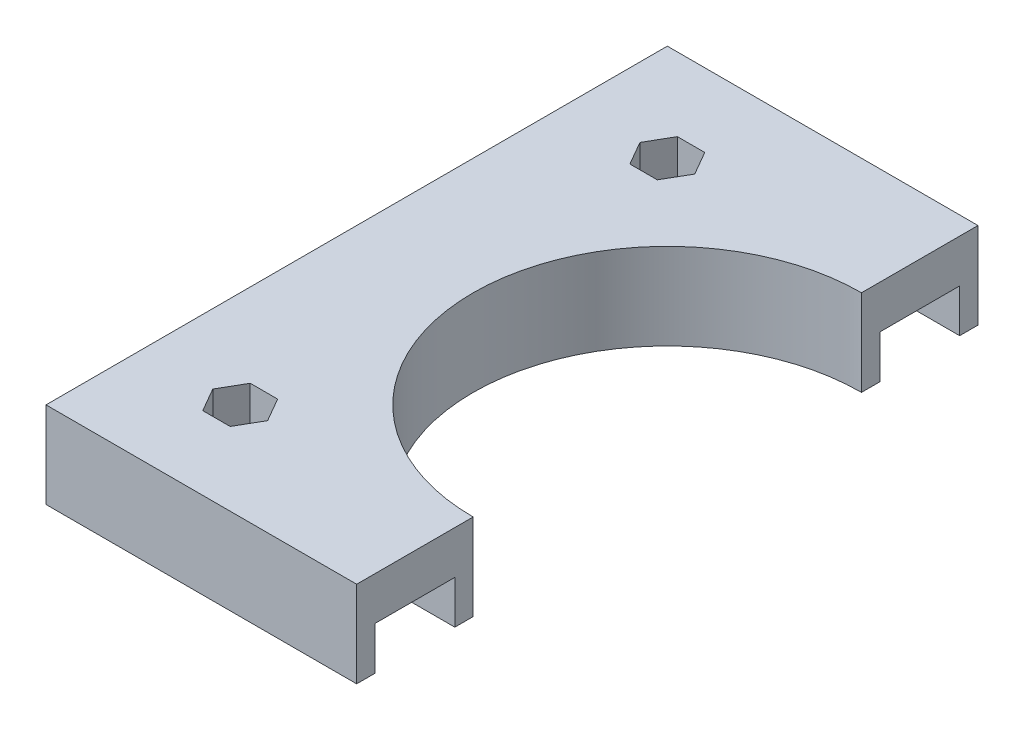
from build123d import *

# Parameters (mm, degrees)
BOSS_EXTRUDE1_DEPTH      = 5
BOSS_EXTRUDE1_DEPTH_BACK = 5
SKETCH1_R                = 1.5
CUT_EXTRUDE1_DEPTH       = 5
SKETCH4_W                = 9.454278837
SKETCH4_H                = 9.25
CUT_EXTRUDE2_DEPTH       = 5


with BuildPart() as part:
    # Sketch1 → Boss-Extrude1 (new, two sides: drawn at the far end of the back side and taken through both)
    with BuildSketch(Plane(origin=(0, 0, 0), x_dir=(1, 0, 0), z_dir=(0, 1, 0)).offset(-BOSS_EXTRUDE1_DEPTH_BACK)):
        with BuildLine():
            Line((0, 22.5), (0, 36))
            Line((0, 36), (-36, 36))
            Line((-36, 36), (-36, -36))
            Line((-36, -36), (0, -36))
            Line((0, -36), (0, -22.5))
            ThreePointArc((0, -22.5), (-22.5, 0), (0, 22.5))
        make_face()
        with Locations((-24.748737342, -24.748737342)):
            Circle(SKETCH1_R, mode=Mode.SUBTRACT)
        with Locations((-24.748737342, 24.748737342)):
            Circle(SKETCH1_R, mode=Mode.SUBTRACT)
    extrude(amount=BOSS_EXTRUDE1_DEPTH + BOSS_EXTRUDE1_DEPTH_BACK)

    # Sketch2 → Cut-Extrude1 (cut)
    with BuildSketch(Plane(origin=(0, 5, 0), x_dir=(1, 0, 0), z_dir=(0, 1, 0))):
        Polygon((-23.161024101, 27.498737342), (-26.336450582, 27.498737342), (-27.924163822, 24.748737342), (-26.336450582, 21.998737342), (-23.161024101, 21.998737342), (-21.573310861, 24.748737342), align=None)
    cut_extrude1 = extrude(amount=-CUT_EXTRUDE1_DEPTH, mode=Mode.SUBTRACT)

    # Mirror1: Cut-Extrude1 across plane
    add(cut_extrude1.mirror(Plane.XY), mode=Mode.SUBTRACT)

    # Sketch4 → Cut-Extrude2 (cut)
    with BuildSketch(Plane.XZ.offset(5)):
        with Locations((-4.727139419, -29.25)):
            Rectangle(SKETCH4_W, SKETCH4_H)
    cut_extrude2 = extrude(amount=-CUT_EXTRUDE2_DEPTH, mode=Mode.SUBTRACT)

    # Mirror3: Cut-Extrude2 across plane
    add(cut_extrude2.mirror(Plane.XY), mode=Mode.SUBTRACT)


solid = part.part
